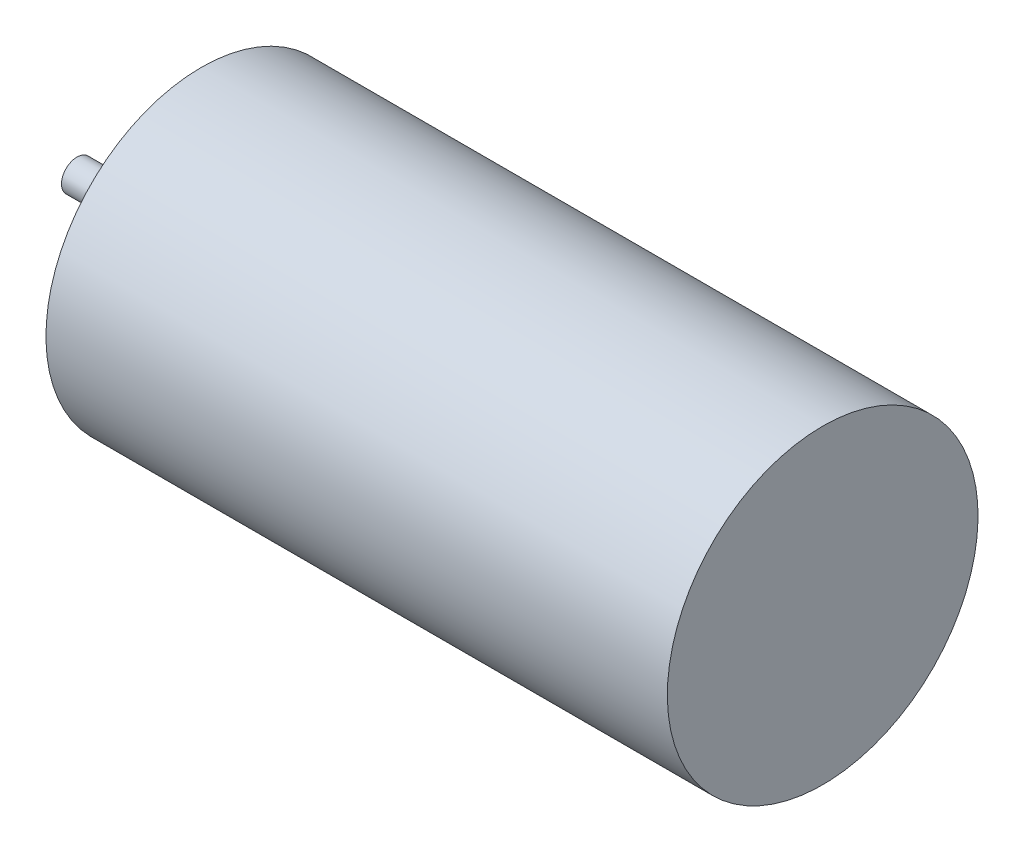
from build123d import *


with BuildPart() as part:
    # Sketch1 → Revolve1 (revolve)
    with BuildSketch(Plane.XY):
        Polygon((0, 1), (0, 10), (40, 10), (40, 0), (0, 0), (-8, 0), (-8, 1), align=None)
    revolve(axis=Axis((40, 0, 0), (-1, 0, 0)))


solid = part.part
